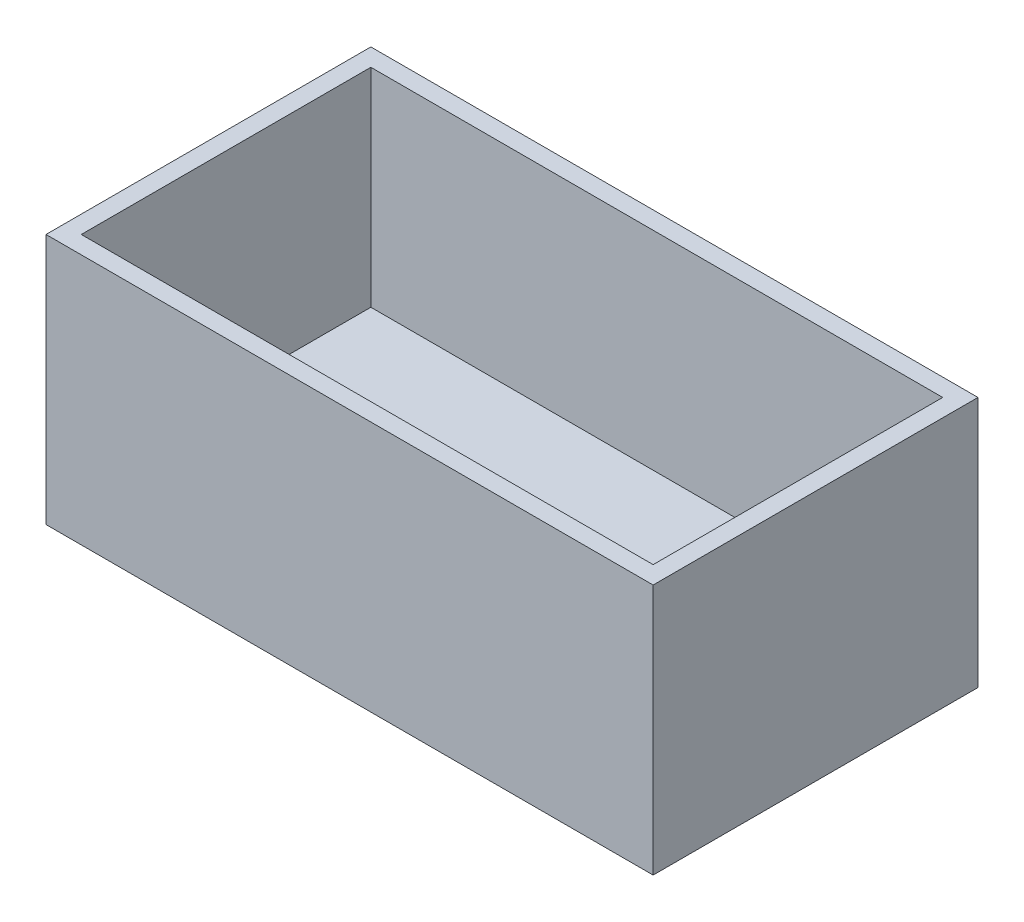
from build123d import *

# Parameters (mm, degrees)
SKETCH1_W           = 1311.148
SKETCH1_H           = 701.548
BOSS_EXTRUDE1_DEPTH = 542.544
CUT_EXTRUDE1_START  = 542.544
SKETCH1_4_W         = 1234.948
SKETCH1_4_H         = 625.348
CUT_EXTRUDE1_DEPTH  = 448.818


with BuildPart() as part:
    # Sketch1 → Boss-Extrude1 (new body)
    with BuildSketch(Plane(origin=(0, 0, 0), x_dir=(1, 0, 0), z_dir=(0, 1, 0))):
        Rectangle(SKETCH1_W, SKETCH1_H)
    extrude(amount=BOSS_EXTRUDE1_DEPTH)

    # Sketch1<4> → Cut-Extrude1 (cut)
    with BuildSketch(Plane(origin=(0, 0, 0), x_dir=(1, 0, 0), z_dir=(0, 1, 0)).offset(CUT_EXTRUDE1_START)):
        Rectangle(SKETCH1_4_W, SKETCH1_4_H)
    extrude(amount=-CUT_EXTRUDE1_DEPTH, mode=Mode.SUBTRACT)


solid = part.part
